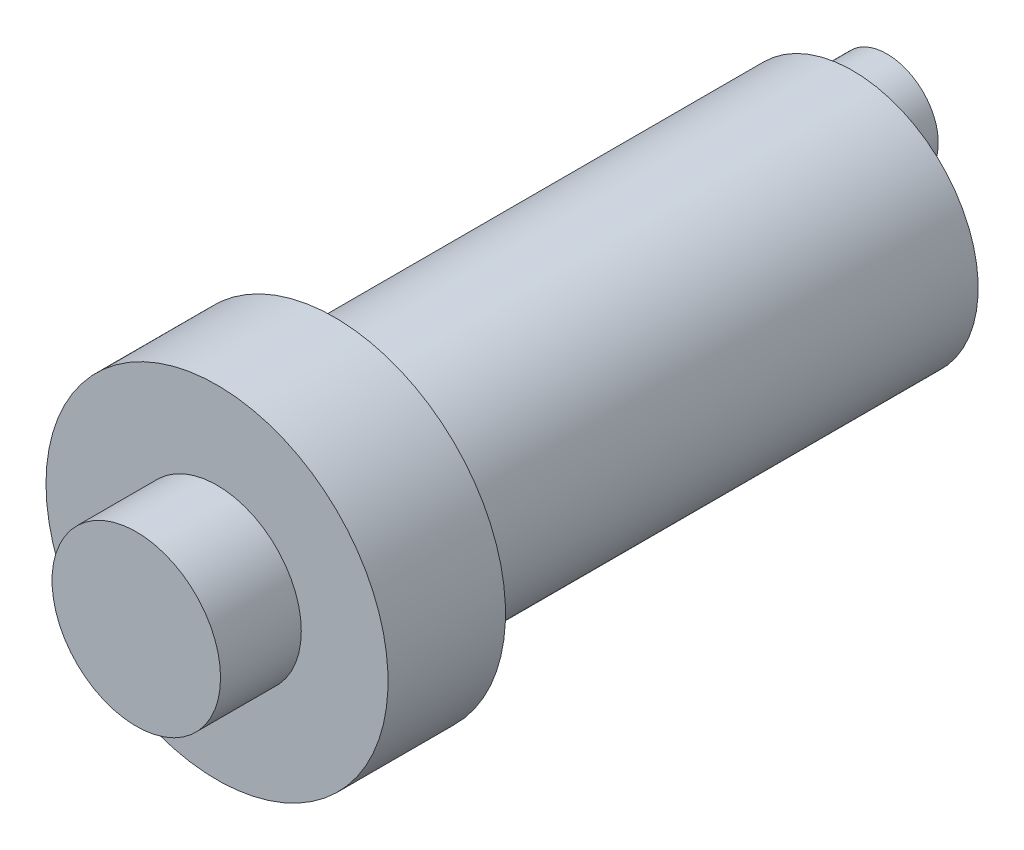
from build123d import *

# Parameters (mm, degrees)
ESQUISSE1_R        = 5.74
BOSS_EXTRU_1_DEPTH = 5.5
ESQUISSE2_R        = 11.65
BOSS_EXTRU_2_DEPTH = 8
ESQUISSE3_R        = 8.55
BOSS_EXTRU_3_DEPTH = 35.3
ESQUISSE4_R        = 3.5
BOSS_EXTRU_4_DEPTH = 7.2


with BuildPart() as part:
    # Esquisse1 → Boss.-Extru.1 (new body)
    with BuildSketch(Plane.XY):
        Circle(ESQUISSE1_R)
    extrude(amount=BOSS_EXTRU_1_DEPTH)

    # Esquisse2 → Boss.-Extru.2 (add)
    with BuildSketch(Plane(origin=(0, 0, 0), x_dir=(-1, 0, 0), z_dir=(0, 0, -1))):
        Circle(ESQUISSE2_R)
    extrude(amount=BOSS_EXTRU_2_DEPTH)

    # Esquisse3 → Boss.-Extru.3 (add)
    with BuildSketch(Plane(origin=(0, 0, -8), x_dir=(-1, 0, 0), z_dir=(0, 0, -1))):
        Circle(ESQUISSE3_R)
    extrude(amount=BOSS_EXTRU_3_DEPTH)

    # Esquisse4 → Boss.-Extru.4 (add)
    with BuildSketch(Plane(origin=(0, 0, -43.3), x_dir=(-1, 0, 0), z_dir=(0, 0, -1))):
        with Locations((4.865332224, 0)):
            Circle(ESQUISSE4_R)
    extrude(amount=BOSS_EXTRU_4_DEPTH)


solid = part.part
